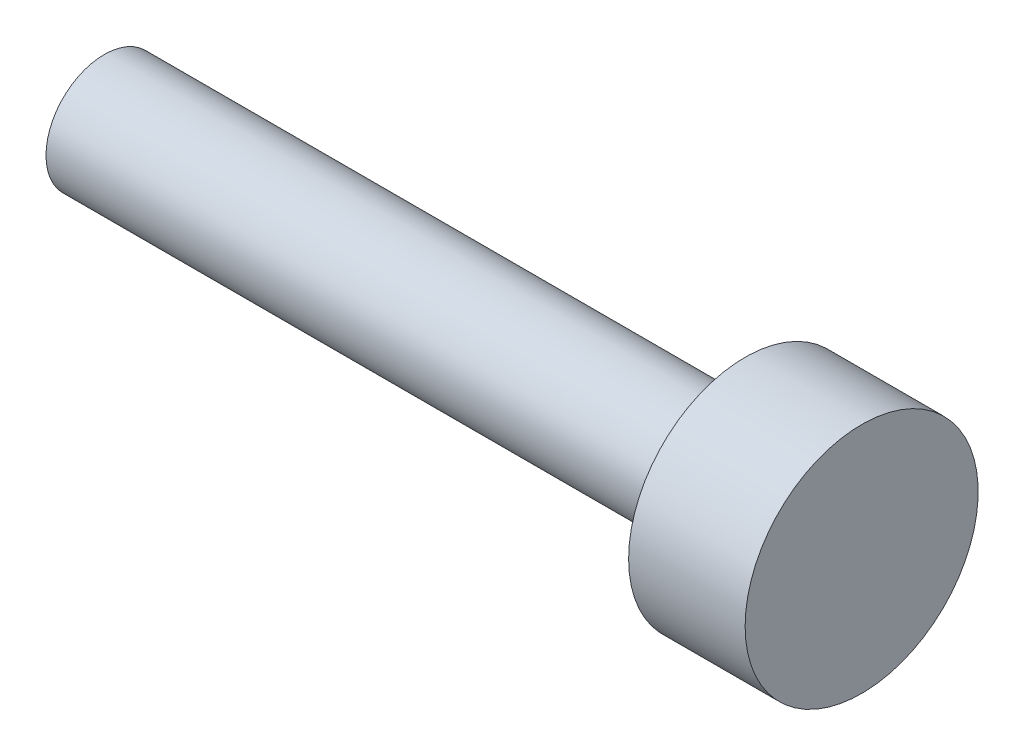
from build123d import *


with BuildPart() as part:
    # Sketch1 → Revolve1 (revolve)
    with BuildSketch(Plane.XY, mode=Mode.PRIVATE) as revolve1_sk:
        Polygon((-116.835752997, 27.175404574), (-105.835752997, 27.175404574), (-105.835752997, 28.175404574), (-103.835752997, 28.175404574), (-103.835752997, 26.175404574), (-116.835752997, 26.175404574), align=None)
    revolve(revolve1_sk.sketch.rotate(Axis((-116.835752997, 26.175404574, 0), (1, 0, 0)), 90), axis=Axis((-116.835752997, 26.175404574, 0), (1, 0, 0)))


solid = part.part
